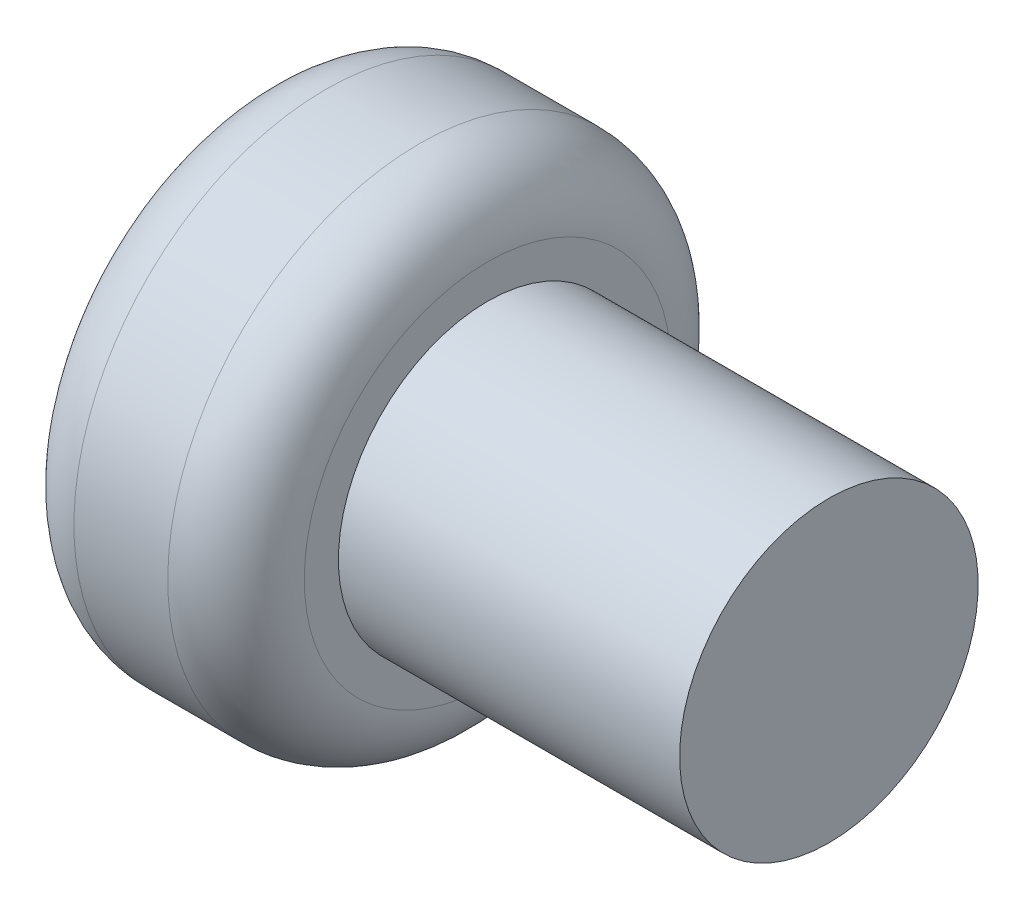
from build123d import *

# Parameters (mm, degrees)
SKETCH_2_W          = 1.7
SKETCH_2_H          = 0.6
SKETCH_2_W_2        = 0.6
SKETCH_2_H_2        = 1.7
CUT_EXTRUDE_1_DEPTH = 0.5
FILLET_1_R          = 0.8


with BuildPart() as part:
    # 草图1 → 旋转1 (revolve)
    with BuildSketch(Plane.XY):
        Polygon((0, 0), (0, 2.95), (2.7, 2.95), (2.7, 1.75), (6.7, 1.75), (6.7, 0), align=None)
    revolve(axis=Axis((6.7, 0, 0), (-1, 0, 0)))

    # 草图2 → 切除-拉伸1 (cut)
    with BuildSketch(Plane.ZY):
        with Locations((1.15, 0)):
            Rectangle(SKETCH_2_W, SKETCH_2_H)
        with Locations((0, -1.15)):
            Rectangle(SKETCH_2_W_2, SKETCH_2_H_2)
        Rectangle(SKETCH_2_W_2, SKETCH_2_H)
        with Locations((0, 1.15)):
            Rectangle(SKETCH_2_W_2, SKETCH_2_H_2)
        with Locations((-1.15, 0)):
            Rectangle(SKETCH_2_W, SKETCH_2_H)
    extrude(amount=-CUT_EXTRUDE_1_DEPTH, mode=Mode.SUBTRACT)

    # 圆角1
    fillet_1_edges = [part.edges().sort_by_distance(p)[0] for p in [
        (2.7, -2.95, 0),
        (0, -2.95, 0),
    ]]
    fillet(fillet_1_edges, radius=FILLET_1_R)


solid = part.part
